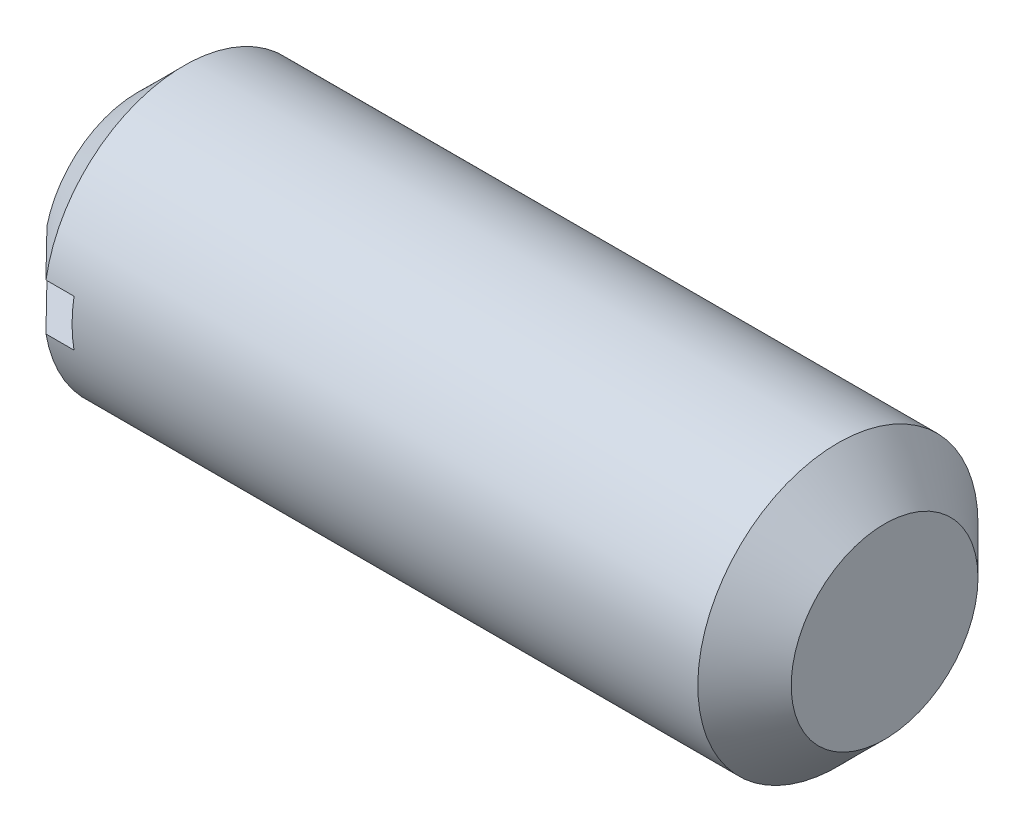
from build123d import *

# Parameters (mm, degrees)
SKETCH_1_R               = 3
EXTRUDE_1_DEPTH          = 16
CUT_EXTRUDE_1_DEPTH      = 17.552945357
CUT_EXTRUDE_1_DEPTH_BACK = 17.552945357
SKETCH_2_W               = 1.6
SKETCH_2_H               = 1
CHAMFER_1_SIZE           = 1


with BuildPart() as part:
    # Эскиз1 → Бобышка-Вытянуть1 (new body)
    with BuildSketch(Plane(origin=(0, 0, 0), x_dir=(0, 0, -1), z_dir=(1, 0, 0))):
        Circle(SKETCH_1_R)
    extrude(amount=EXTRUDE_1_DEPTH)

    # Эскиз2 → Вырез-Вытянуть1 (cut, two sides: drawn at the far end of the back side and taken through both)
    with BuildSketch(Plane.XY.offset(-CUT_EXTRUDE_1_DEPTH_BACK)):
        with Locations((0.8, 0)):
            Rectangle(SKETCH_2_W, SKETCH_2_H)
    extrude(amount=CUT_EXTRUDE_1_DEPTH + CUT_EXTRUDE_1_DEPTH_BACK, mode=Mode.SUBTRACT)

    # Фаска1
    chamfer_1_edges = [part.edges().sort_by_distance(p)[0] for p in [
        (16, 0, 3),
        (0, 3, 0),
        (0, -3, 0),
    ]]
    chamfer(chamfer_1_edges, length=CHAMFER_1_SIZE)


solid = part.part
